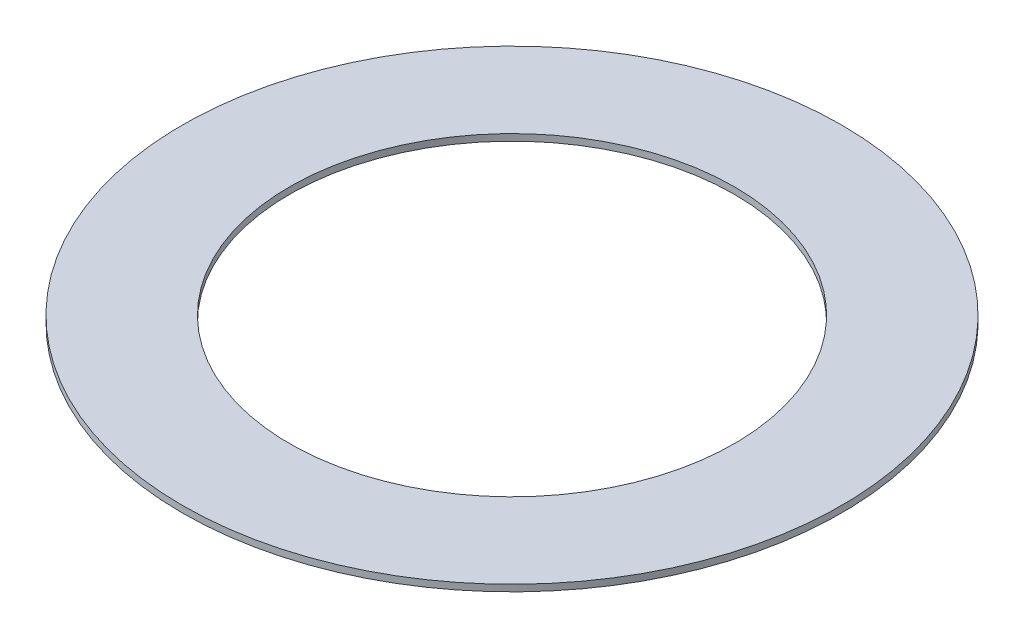
from build123d import *

# Parameters (mm, degrees)
SKETCH_1_W = 3.25
SKETCH_1_H = 0.2


with BuildPart() as part:
    # 草图1 → 旋转1 (revolve)
    with BuildSketch(Plane.XY, mode=Mode.PRIVATE) as revolve_1_sk:
        with Locations((8.375, 0.1)):
            Rectangle(SKETCH_1_W, SKETCH_1_H)
    revolve(revolve_1_sk.sketch.rotate(Axis((0, 0.2, 0), (0, -1, 0)), 270), axis=Axis((0, 0.2, 0), (0, -1, 0)))


solid = part.part
